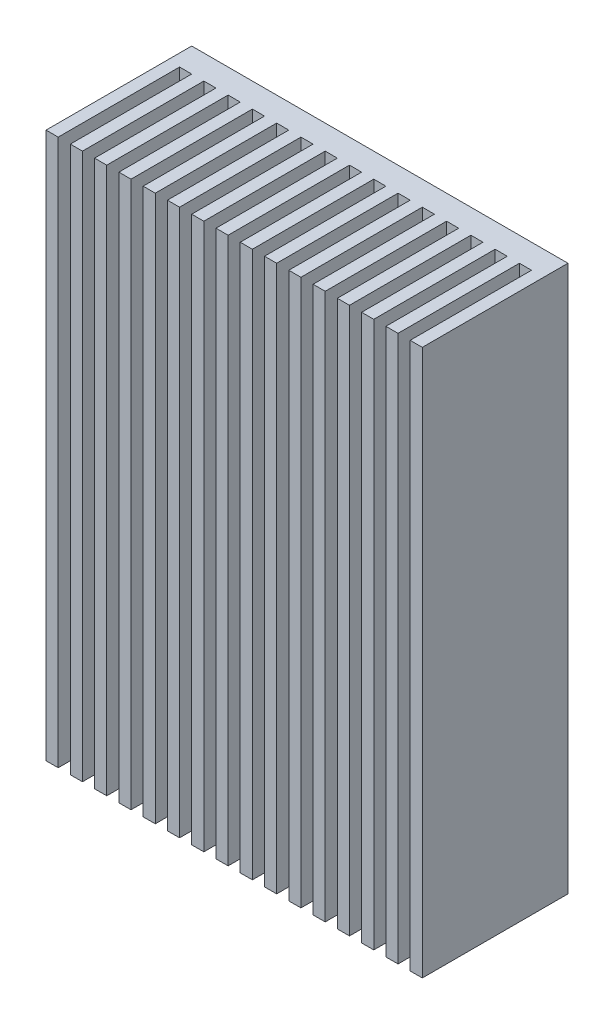
from build123d import *

# Parameters (mm, degrees)
SKETCH1_W           = 1
SKETCH1_H           = 10
BOSS_EXTRUDE1_DEPTH = 45


with BuildPart() as part:
    # Sketch1 → Boss-Extrude1 (new body)
    with BuildSketch(Plane(origin=(0, 0, 0), x_dir=(-1, 0, 0), z_dir=(0, 1, 0))):
        with Locations((0.5, 7)):
            Rectangle(SKETCH1_W, SKETCH1_H)
        Polygon((1, 2), (0, 2), (0, 0), (31, 0), (31, 2), (30, 2), (29, 2), (28, 2), (27, 2), (26, 2), (25, 2), (24, 2), (23, 2), (22, 2), (21, 2), (20, 2), (19, 2), (18, 2), (17, 2), (16, 2), (15, 2), (14, 2), (13, 2), (12, 2), (11, 2), (10, 2), (9, 2), (8, 2), (7, 2), (6, 2), (5, 2), (4, 2), (3, 2), (2, 2), align=None)
        with Locations((2.5, 7)):
            Rectangle(SKETCH1_W, SKETCH1_H)
        with Locations((4.5, 7)):
            Rectangle(SKETCH1_W, SKETCH1_H)
        with Locations((6.5, 7)):
            Rectangle(SKETCH1_W, SKETCH1_H)
        with Locations((8.5, 7)):
            Rectangle(SKETCH1_W, SKETCH1_H)
        with Locations((10.5, 7)):
            Rectangle(SKETCH1_W, SKETCH1_H)
        with Locations((12.5, 7)):
            Rectangle(SKETCH1_W, SKETCH1_H)
        with Locations((14.5, 7)):
            Rectangle(SKETCH1_W, SKETCH1_H)
        with Locations((16.5, 7)):
            Rectangle(SKETCH1_W, SKETCH1_H)
        with Locations((18.5, 7)):
            Rectangle(SKETCH1_W, SKETCH1_H)
        with Locations((20.5, 7)):
            Rectangle(SKETCH1_W, SKETCH1_H)
        with Locations((22.5, 7)):
            Rectangle(SKETCH1_W, SKETCH1_H)
        with Locations((24.5, 7)):
            Rectangle(SKETCH1_W, SKETCH1_H)
        with Locations((26.5, 7)):
            Rectangle(SKETCH1_W, SKETCH1_H)
        with Locations((28.5, 7)):
            Rectangle(SKETCH1_W, SKETCH1_H)
        with Locations((30.5, 7)):
            Rectangle(SKETCH1_W, SKETCH1_H)
    extrude(amount=BOSS_EXTRUDE1_DEPTH)


solid = part.part
